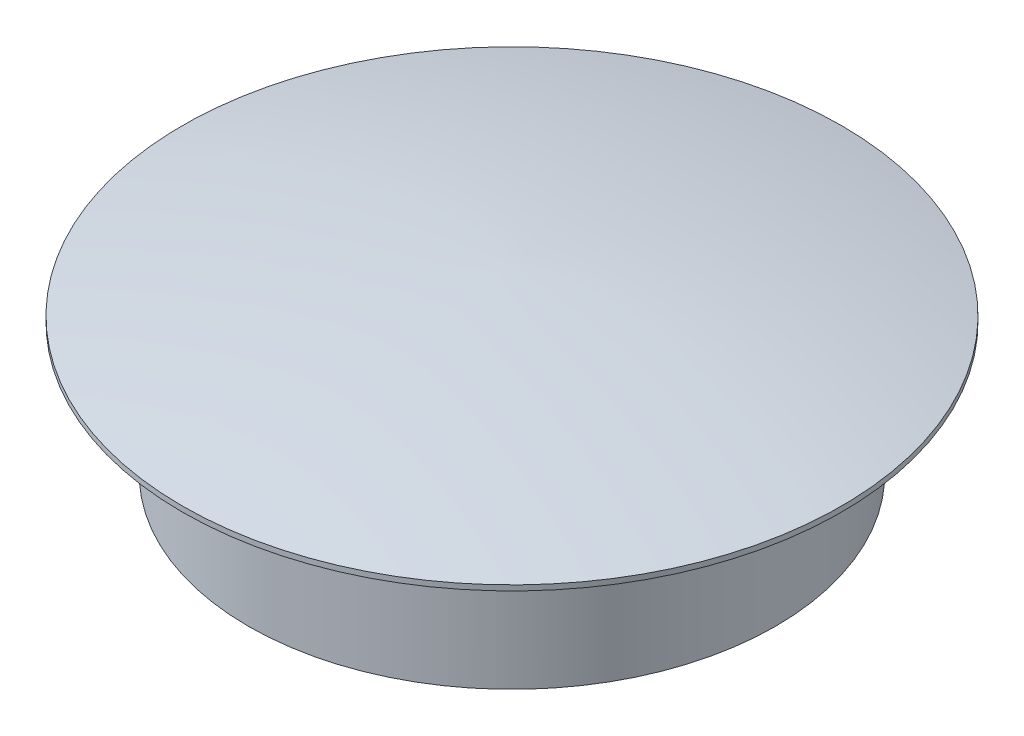
from build123d import *

# Parameters (mm, degrees)
SKETCH1_R           = 15.875
BOSS_EXTRUDE1_DEPTH = 0.254
SKETCH2_R           = 12.7
SKETCH2_R_2         = 11.43
BOSS_EXTRUDE2_DEPTH = 6.35


with BuildPart() as part:
    # Sketch1 → Boss-Extrude1 (new body)
    with BuildSketch(Plane(origin=(0, 0, 0), x_dir=(1, 0, 0), z_dir=(0, 1, 0))):
        with Locations(Location((0, 0, 0), (0, 0, 270))):
            Circle(SKETCH1_R)
    extrude(amount=BOSS_EXTRUDE1_DEPTH)

    # Sketch2 → Boss-Extrude2 (add)
    with BuildSketch(Plane.XZ):
        with Locations(Location((0, 0, 0), (0, 0, 90))):
            Circle(SKETCH2_R)
        with Locations(Location((0, 0, 0), (0, 0, 270))):
            Circle(SKETCH2_R_2, mode=Mode.SUBTRACT)
    extrude(amount=BOSS_EXTRUDE2_DEPTH)

    # Sketch4 → Revolve1 (revolve)
    with BuildSketch(Plane.XY):
        with BuildLine():
            Line((0, 0.254), (0, 2.432834291))
            ThreePointArc((0, 2.432834291), (7.996729181, 1.774961324), (15.875, 0.254))
            Line((15.875, 0.254), (0, 0.254))
        make_face()
    revolve(axis=Axis((0, 0.254, 0), (0, 1, 0)))


solid = part.part
